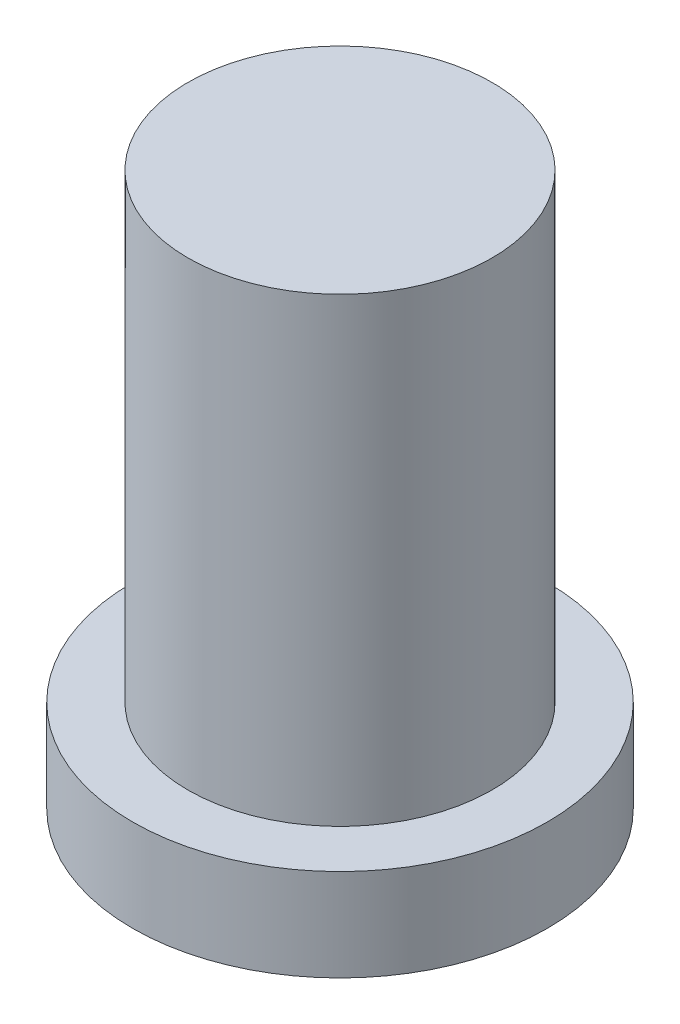
from build123d import *

# Parameters (mm, degrees)
SKETCH1_R           = 3.3
BOSS_EXTRUDE1_DEPTH = 12
SKETCH1_3_R         = 4.5
SKETCH1_3_R_2       = 3.3
BOSS_EXTRUDE2_DEPTH = 2


with BuildPart() as part:
    # Sketch1 → Boss-Extrude1 (new body)
    with BuildSketch(Plane(origin=(0, 0, 0), x_dir=(1, 0, 0), z_dir=(0, 1, 0))):
        Circle(SKETCH1_R)
    extrude(amount=BOSS_EXTRUDE1_DEPTH)

    # Sketch1<3> → Boss-Extrude2 (add)
    with BuildSketch(Plane(origin=(0, 0, 0), x_dir=(1, 0, 0), z_dir=(0, 1, 0))):
        Circle(SKETCH1_3_R)
        Circle(SKETCH1_3_R_2, mode=Mode.SUBTRACT)
    extrude(amount=BOSS_EXTRUDE2_DEPTH)


solid = part.part
